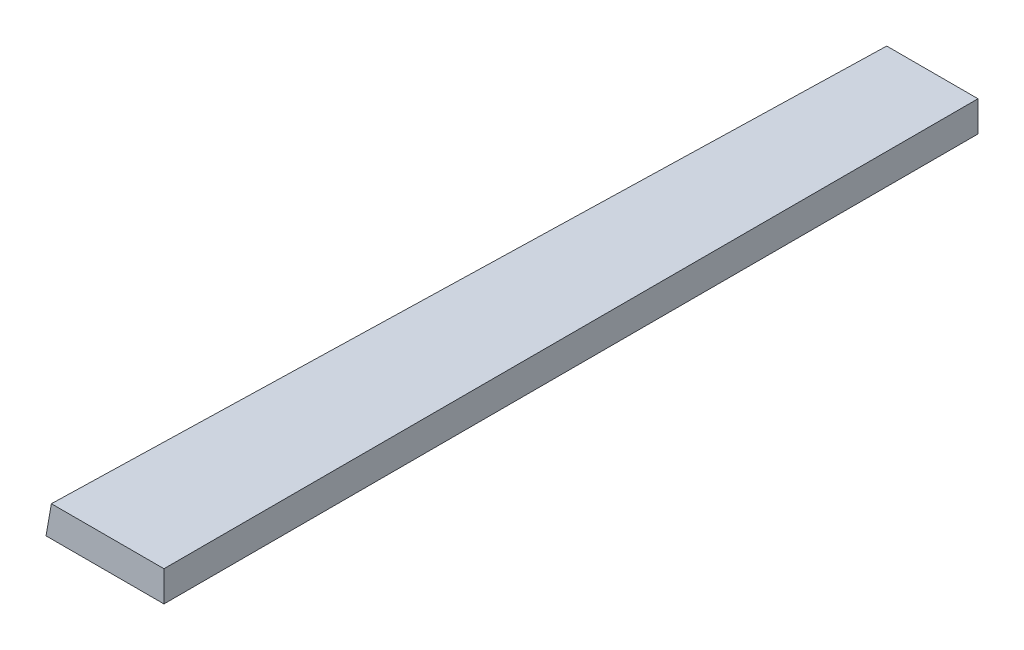
from build123d import *

# Parameters (mm, degrees)
SKETCH1_W               = 76.2
SKETCH1_H               = 508
BOSS_EXTRUDE1_DEPTH     = 19.05
CUT_EXTRUDE1_DEPTH      = 294.7685785
CUT_EXTRUDE1_DEPTH_BACK = 294.7685785
SKETCH2_W               = 2.54
SKETCH2_H               = 127


with BuildPart() as part:
    # Sketch1 → Boss-Extrude1 (new body)
    with BuildSketch(Plane(origin=(0, 0, 0), x_dir=(1, 0, 0), z_dir=(0, 1, 0))):
        Rectangle(SKETCH1_W, SKETCH1_H)
    extrude(amount=BOSS_EXTRUDE1_DEPTH)

    # Sketch2 → Cut-Extrude1 (cut, two sides: drawn at the far end of the back side and taken through both)
    with BuildSketch(Plane(origin=(71.418451956, -42.231341714, 11.613033477), x_dir=(0.9844702839913745, -0.1736481776669235, 0.025779261643793124), z_dir=(-0.022593572510051476, 0.020297753345166498, 0.9995386594276241)).offset(-CUT_EXTRUDE1_DEPTH_BACK)):
        with Locations((-107.6325, 0)):
            Rectangle(SKETCH2_W, SKETCH2_H)
    extrude(amount=CUT_EXTRUDE1_DEPTH + CUT_EXTRUDE1_DEPTH_BACK, mode=Mode.SUBTRACT)


with BuildPart() as cut_extrude1_kept_piece:
    # of the separate pieces the step leaves, the one the design keeps (cut_extrude1_pieces_kept)
    add(part.part.solids().sort_by_distance((38.1, 0, -254))[0])


solid = cut_extrude1_kept_piece.part
